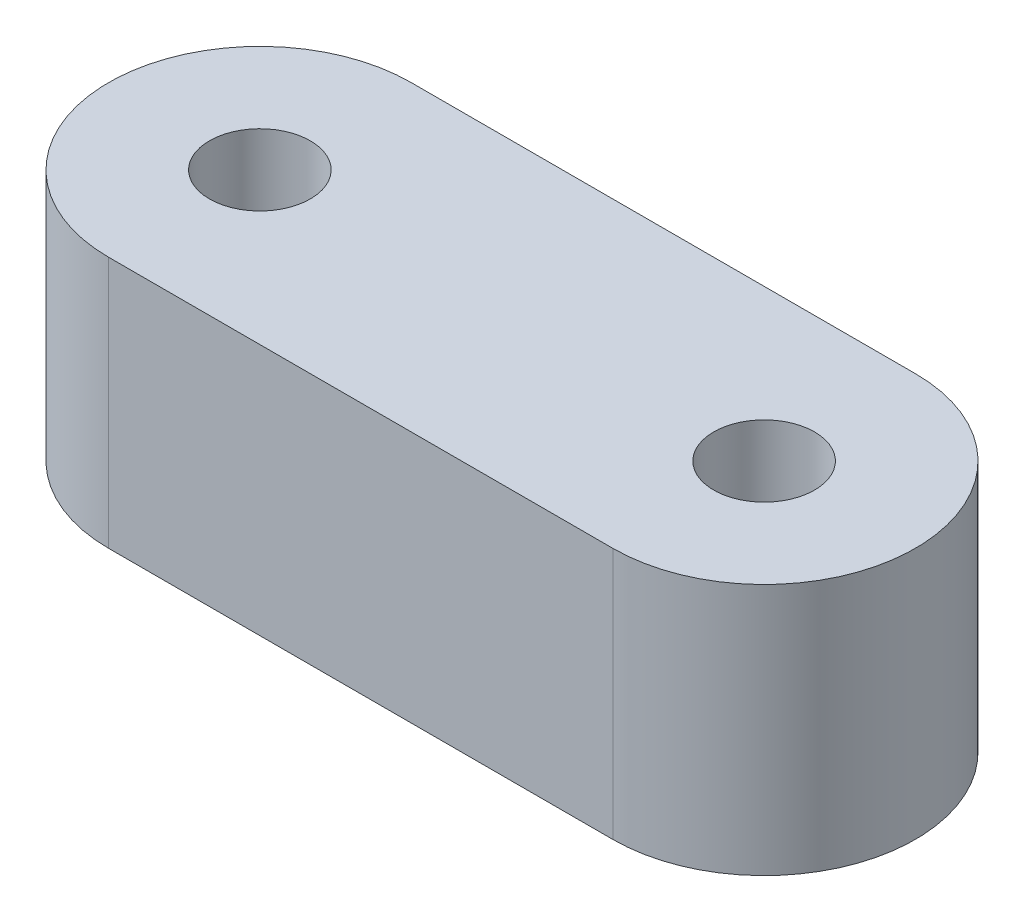
from build123d import *

# Parameters (mm, degrees)
BOSS_EXTRUDE1_DEPTH = 12.7
SKETCH4_R           = 2.54
CUT_EXTRUDE3_DEPTH  = 73.645776202


with BuildPart() as part:
    # Sketch3 → Boss-Extrude1 (new body)
    with BuildSketch(Plane(origin=(0, 0, 0), x_dir=(1, 0, 0), z_dir=(0, 1, 0))):
        with BuildLine():
            Line((-63.5, 7.62), (-38.1, 7.62))
            ThreePointArc((-38.1, 7.62), (-30.48, 0), (-38.1, -7.62))
            Line((-38.1, -7.62), (-63.5, -7.62))
            ThreePointArc((-63.5, -7.62), (-71.12, 0), (-63.5, 7.62))
        make_face()
    extrude(amount=BOSS_EXTRUDE1_DEPTH)

    # Sketch4 → Cut-Extrude3 (cut, through all)
    with BuildSketch(Plane(origin=(0, 12.7, 0), x_dir=(1, 0, 0), z_dir=(0, 1, 0))):
        with Locations(Location((-63.5, 0, 0), (0, 0, 270))):
            Circle(SKETCH4_R)
        with Locations(Location((-38.1, 0, 0), (0, 0, 90))):
            Circle(SKETCH4_R)
    extrude(amount=-CUT_EXTRUDE3_DEPTH, mode=Mode.SUBTRACT)


solid = part.part
